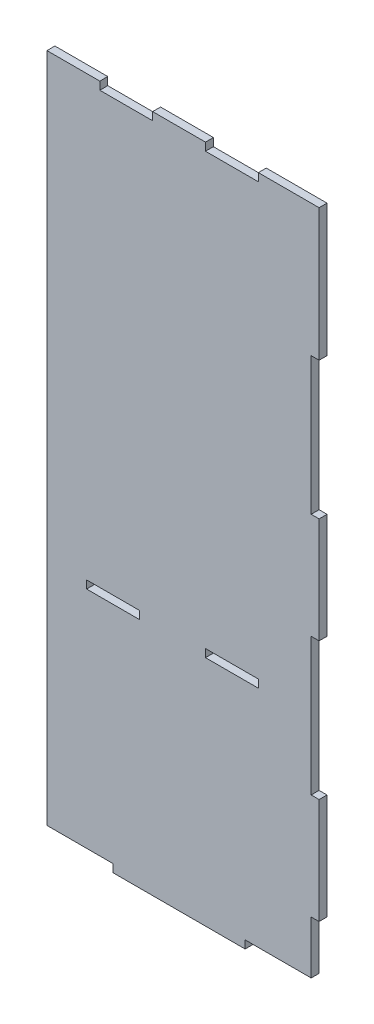
from build123d import *

# Parameters (mm, degrees)
SKETCH1_W           = 100
SKETCH1_H           = 254
BOSS_EXTRUDE1_DEPTH = 3
SKETCH2_W           = 50
SKETCH2_H           = 3
BOSS_EXTRUDE2_DEPTH = 3
SKETCH3_W           = 20
SKETCH3_H           = 3
CUT_EXTRUDE1_DEPTH  = 3
SKETCH4_W           = 3
SKETCH4_H           = 40
SKETCH4_H_2         = 50
BOSS_EXTRUDE3_DEPTH = 3
SKETCH5_W           = 20
SKETCH5_H           = 3
CUT_EXTRUDE2_DEPTH  = 3


with BuildPart() as part:
    # Sketch1 → Boss-Extrude1 (new body)
    with BuildSketch(Plane.XY):
        with Locations((-9.252144082, -28.319039451)):
            Rectangle(SKETCH1_W, SKETCH1_H)
    extrude(amount=BOSS_EXTRUDE1_DEPTH)

    # Sketch2 → Boss-Extrude2 (add)
    with BuildSketch(Plane.XZ.offset(155.319039451)):
        with Locations((-9.252144082, 1.5)):
            Rectangle(SKETCH2_W, SKETCH2_H)
    extrude(amount=BOSS_EXTRUDE2_DEPTH)

    # Sketch3 → Cut-Extrude1 (cut)
    with BuildSketch(Plane(origin=(0, 98.680960549, 0), x_dir=(1, 0, 0), z_dir=(0, 1, 0))):
        with Locations((-29.252144082, -1.5)):
            Rectangle(SKETCH3_W, SKETCH3_H)
        with Locations((10.747855918, -1.5)):
            Rectangle(SKETCH3_W, SKETCH3_H)
    extrude(amount=-CUT_EXTRUDE1_DEPTH, mode=Mode.SUBTRACT)

    # Sketch4 → Boss-Extrude3 (add)
    with BuildSketch(Plane(origin=(40.747855918, 0, 0), x_dir=(0, 0, -1), z_dir=(1, 0, 0))):
        with Locations((-1.5, -115.319039451)):
            Rectangle(SKETCH4_W, SKETCH4_H)
        with Locations((-1.5, -23.319039451)):
            Rectangle(SKETCH4_W, SKETCH4_H)
        with Locations((-1.5, 73.680960549)):
            Rectangle(SKETCH4_W, SKETCH4_H_2)
    extrude(amount=BOSS_EXTRUDE3_DEPTH)

    # Sketch5 → Cut-Extrude2 (cut)
    with BuildSketch(Plane(origin=(0, 0, 0), x_dir=(-1, 0, 0), z_dir=(0, 0, -1))):
        with Locations((-10.747855918, -68.819039451)):
            Rectangle(SKETCH5_W, SKETCH5_H)
        with Locations((34.252144082, -68.819039451)):
            Rectangle(SKETCH5_W, SKETCH5_H)
    extrude(amount=-CUT_EXTRUDE2_DEPTH, mode=Mode.SUBTRACT)


solid = part.part
